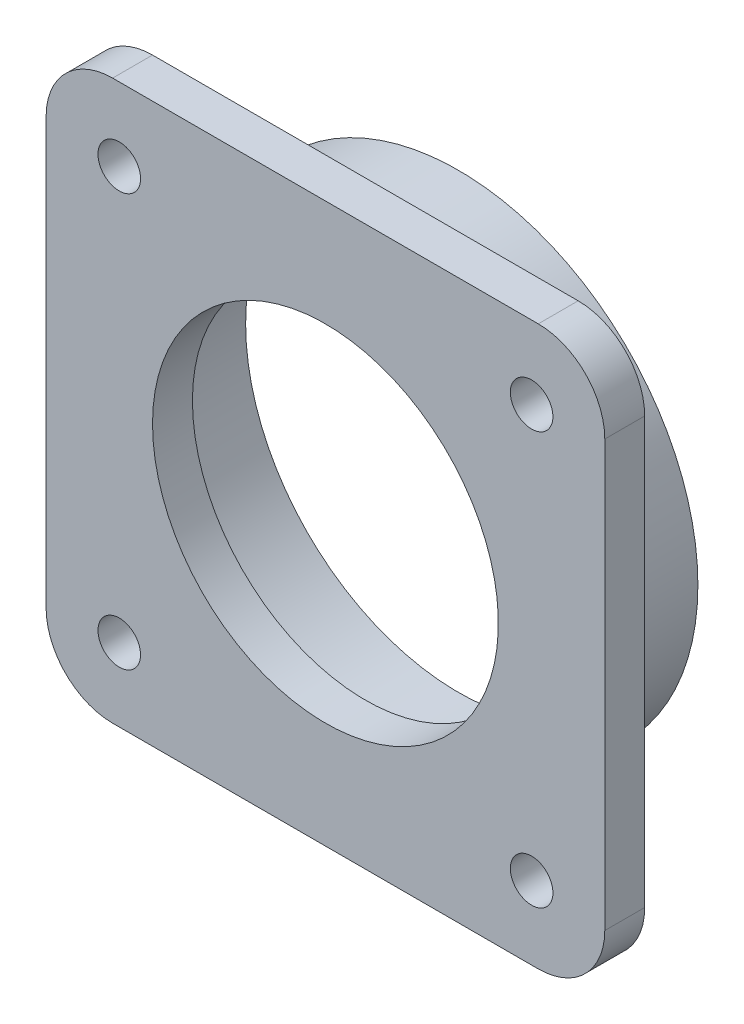
from build123d import *

# Parameters (mm, degrees)
SKETCH_1_W          = 42
SKETCH_1_H          = 42
SKETCH_1_R          = 1.6
SKETCH_1_R_2        = 11
EXTRUDE_1_DEPTH     = 3
FILLET_1_R          = 5
SKETCH_2_R          = 18
SKETCH_2_R_2        = 16
EXTRUDE_2_DEPTH     = 7
SKETCH_3_R          = 13
CUT_EXTRUDE_1_DEPTH = 3


with BuildPart() as part:
    # 草图1 → 凸台-拉伸1 (new body)
    with BuildSketch(Plane.XY):
        Rectangle(SKETCH_1_W, SKETCH_1_H)
        with Locations((-15.5, 15.5)):
            Circle(SKETCH_1_R, mode=Mode.SUBTRACT)
        with Locations((15.5, 15.5)):
            Circle(SKETCH_1_R, mode=Mode.SUBTRACT)
        with Locations((15.5, -15.5)):
            Circle(SKETCH_1_R, mode=Mode.SUBTRACT)
        with Locations((-15.5, -15.5)):
            Circle(SKETCH_1_R, mode=Mode.SUBTRACT)
        Circle(SKETCH_1_R_2, mode=Mode.SUBTRACT)
    extrude(amount=EXTRUDE_1_DEPTH)

    # 圆角1
    fillet_1_edges = [part.edges().sort_by_distance(p)[0] for p in [
        (-21, -21, 1.5),
        (-21, 21, 1.5),
        (21, 21, 1.5),
        (21, -21, 1.5),
    ]]
    fillet(fillet_1_edges, radius=FILLET_1_R)

    # 草图2 → 凸台-拉伸2 (add)
    with BuildSketch(Plane(origin=(0, 0, 0), x_dir=(-1, 0, 0), z_dir=(0, 0, -1))):
        with Locations(Location((0, 0, 0), (0, 0, 180))):
            Circle(SKETCH_2_R)
        Circle(SKETCH_2_R_2, mode=Mode.SUBTRACT)
    extrude(amount=EXTRUDE_2_DEPTH)

    # 草图3 → 切除-拉伸1 (cut)
    with BuildSketch(Plane(origin=(0, 0, 0), x_dir=(-1, 0, 0), z_dir=(0, 0, -1))):
        Circle(SKETCH_3_R)
    extrude(amount=-CUT_EXTRUDE_1_DEPTH, mode=Mode.SUBTRACT)


solid = part.part
